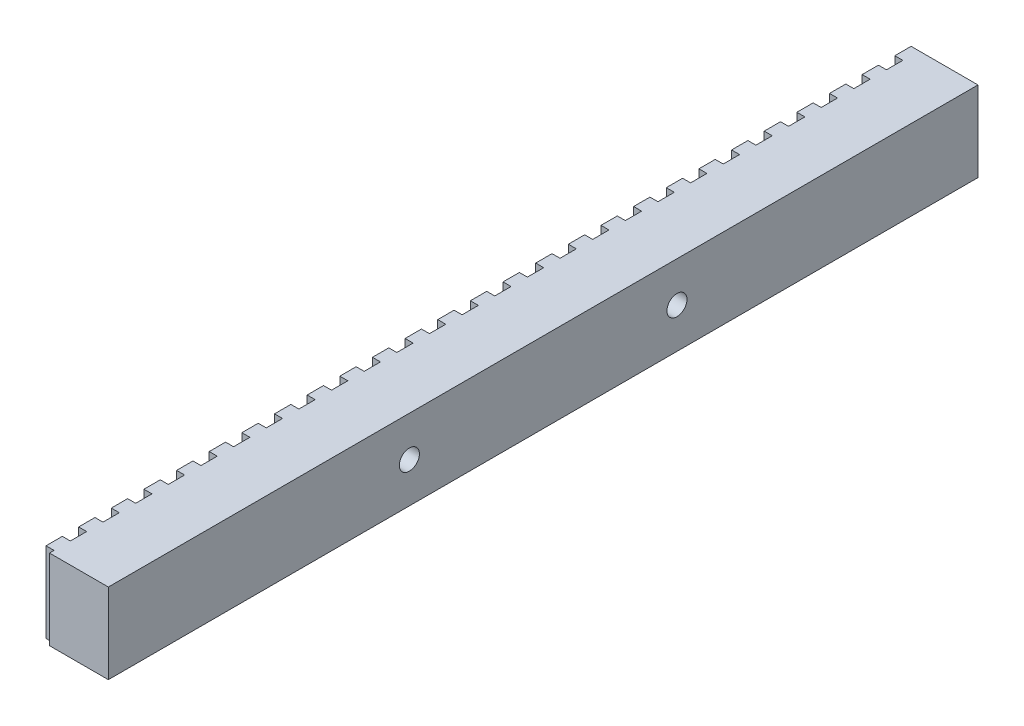
from build123d import *

# Parameters (mm, degrees)
SKETCH_1_W          = 65
SKETCH_1_H          = 6
SKETCH_1_R          = 0.75
EXTRUDE_1_DEPTH     = 5
CUT_EXTRUDE_1_DEPTH = 15


with BuildPart() as part:
    # Эскиз1 → Бобышка-Вытянуть1 (new body)
    with BuildSketch(Plane(origin=(0, 0, 0), x_dir=(0, 0, -1), z_dir=(1, 0, 0))):
        with Locations((3.998772772, 5.663725322)):
            Rectangle(SKETCH_1_W, SKETCH_1_H)
        with Locations((-6.001227228, 5.663725322)):
            Circle(SKETCH_1_R, mode=Mode.SUBTRACT)
        with Locations((13.998772772, 5.663725322)):
            Circle(SKETCH_1_R, mode=Mode.SUBTRACT)
    extrude(amount=EXTRUDE_1_DEPTH)

    # Эскиз2 → Вырез-Вытянуть1 (cut)
    with BuildSketch(Plane(origin=(0, 8.663725322, 0), x_dir=(1, 0, 0), z_dir=(0, 1, 0))):
        Polygon((0, 35.278772772), (0, 36.498772772), (-0.186026499, 36.498772772), (-0.186026499, -29.381227228), (0.6, -29.381227228), (0.6, -28.161227228), (0, -28.161227228), (0, -26.941227228), (0.6, -26.941227228), (0.6, -25.721227228), (0, -25.721227228), (0, -24.501227228), (0.6, -24.501227228), (0.6, -23.281227228), (0, -23.281227228), (0, -22.061227228), (0.6, -22.061227228), (0.6, -20.841227228), (0, -20.841227228), (0, -19.621227228), (0.6, -19.621227228), (0.6, -18.401227228), (0, -18.401227228), (0, -17.181227228), (0.6, -17.181227228), (0.6, -15.961227228), (0, -15.961227228), (0, -14.741227228), (0.6, -14.741227228), (0.6, -13.521227228), (0, -13.521227228), (0, -12.301227228), (0.6, -12.301227228), (0.6, -11.081227228), (0, -11.081227228), (0, -9.861227228), (0.6, -9.861227228), (0.6, -8.641227228), (0, -8.641227228), (0, -7.421227228), (0.6, -7.421227228), (0.6, -6.201227228), (0, -6.201227228), (0, -4.981227228), (0.6, -4.981227228), (0.6, -3.761227228), (0, -3.761227228), (0, -2.541227228), (0.6, -2.541227228), (0.6, -1.321227228), (0, -1.321227228), (0, -0.101227228), (0.6, -0.101227228), (0.6, 1.118772772), (0, 1.118772772), (0, 2.338772772), (0.6, 2.338772772), (0.6, 3.558772772), (0, 3.558772772), (0, 4.778772772), (0.6, 4.778772772), (0.6, 5.998772772), (0, 5.998772772), (0, 7.218772772), (0.6, 7.218772772), (0.6, 8.438772772), (0, 8.438772772), (0, 9.658772772), (0.6, 9.658772772), (0.6, 10.878772772), (0, 10.878772772), (0, 12.098772772), (0.6, 12.098772772), (0.6, 13.318772772), (0, 13.318772772), (0, 14.538772772), (0.6, 14.538772772), (0.6, 15.758772772), (0, 15.758772772), (0, 16.978772772), (0.6, 16.978772772), (0.6, 18.198772772), (0, 18.198772772), (0, 19.418772772), (0.6, 19.418772772), (0.6, 20.638772772), (0, 20.638772772), (0, 21.858772772), (0.6, 21.858772772), (0.6, 23.078772772), (0, 23.078772772), (0, 24.298772772), (0.6, 24.298772772), (0.6, 25.518772772), (0, 25.518772772), (0, 26.738772772), (0.6, 26.738772772), (0.6, 27.958772772), (0, 27.958772772), (0, 29.178772772), (0.6, 29.178772772), (0.6, 30.398772772), (0, 30.398772772), (0, 31.618772772), (0.6, 31.618772772), (0.6, 32.838772772), (0, 32.838772772), (0, 34.058772772), (0.6, 34.058772772), (0.6, 35.278772772), align=None)
    extrude(amount=-CUT_EXTRUDE_1_DEPTH, mode=Mode.SUBTRACT)


solid = part.part
